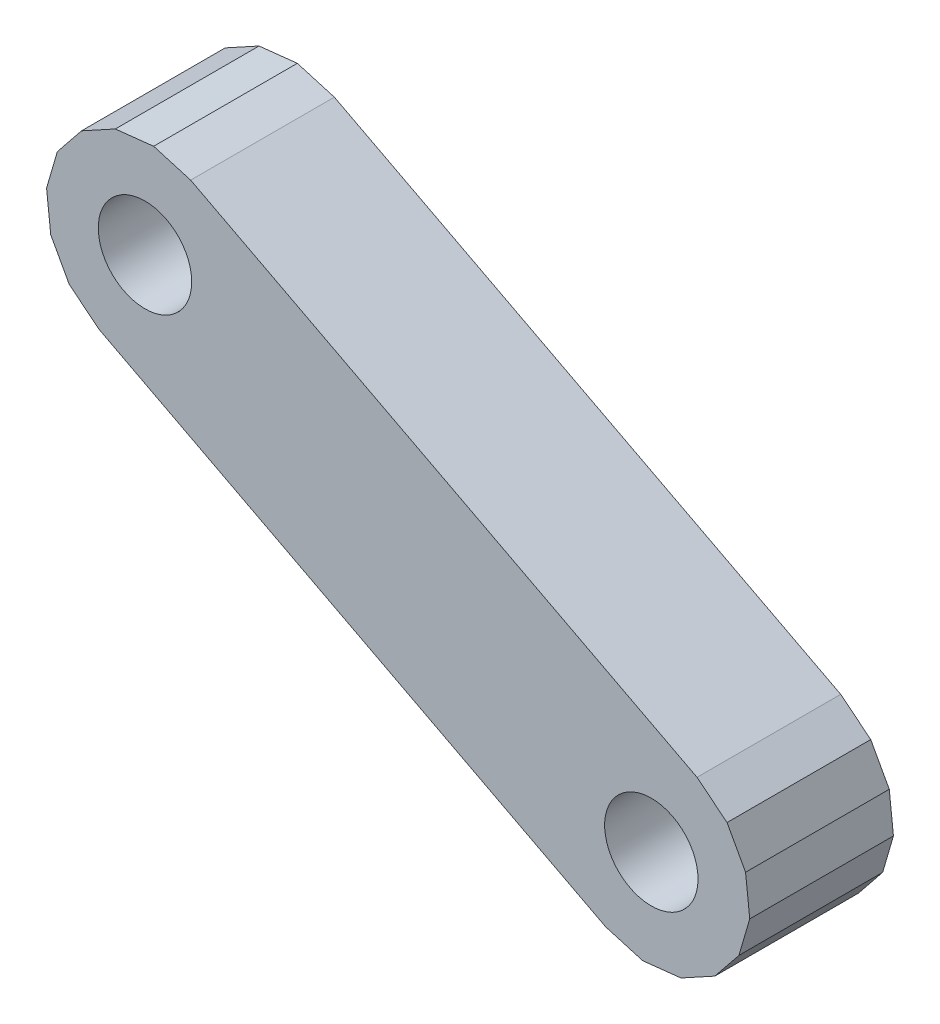
from build123d import *

# Parameters (mm, degrees)
HIGH_SLIDER_LINK_DEPTH = 8
SKETCH_2_R             = 2.6
PIN_BORE_DEPTH         = 67.137967524
SKETCH_3_R             = 2.6
CUT_EXTRUDE_2_DEPTH    = 67.137967524


with BuildPart() as part:
    # 草图1 → High_slider_link (new body)
    with BuildSketch(Plane.XY):
        Polygon((-43.733202086, 35.819954019), (-45.406009546, 37.164202316), (-46.437060568, 39.046281505), (-46.66938698, 41.17966209), (-46.067619192, 43.239556216), (-44.723370895, 44.912363676), (-42.841291706, 45.943414698), (-40.707911121, 46.17574111), (-38.648016994, 45.573973323), (-10.457407454, 30.877009652), (-8.784599994, 29.532761355), (-7.753548972, 27.650682166), (-7.52122256, 25.517301581), (-8.122990348, 23.457407454), (-9.467238645, 21.784599994), (-11.349317834, 20.753548972), (-13.482698419, 20.52122256), (-15.542592546, 21.122990348), align=None)
    extrude(amount=HIGH_SLIDER_LINK_DEPTH)

    # 草图2 → Pin_bore (cut, through all)
    with BuildSketch(Plane.XY.offset(8)):
        with Locations((-41.19060954, 40.696963671)):
            Circle(SKETCH_2_R)
    extrude(amount=-PIN_BORE_DEPTH, mode=Mode.SUBTRACT)

    # 草图3 → 切除-拉伸2 (cut, through all)
    with BuildSketch(Plane.XY.offset(8)):
        with Locations((-13, 26)):
            Circle(SKETCH_3_R)
    extrude(amount=-CUT_EXTRUDE_2_DEPTH, mode=Mode.SUBTRACT)


solid = part.part
